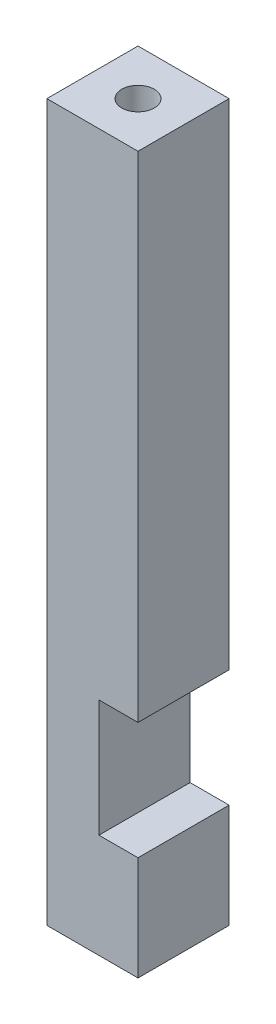
from build123d import *

# Parameters (mm, degrees)
BOSS_EXTRUDE1_DEPTH = 55
SKETCH2_R           = 1.25
CUT_EXTRUDE1_DEPTH  = 12
SKETCH4_W           = 7
SKETCH4_H           = 9
CUT_EXTRUDE3_DEPTH  = 3
CUT_EXTRUDE4_START  = -5
SKETCH3_R           = 1.25
CUT_EXTRUDE4_DEPTH  = 5


with BuildPart() as part:
    # Sketch1 → Boss-Extrude1 (new body)
    with BuildSketch(Plane(origin=(0, 0, 0), x_dir=(1, 0, 0), z_dir=(0, 1, 0))):
        Polygon((0, 3.5), (-3.5, 3.5), (-3.5, -3.5), (3.5, -3.5), (3.5, 3.5), align=None)
    extrude(amount=BOSS_EXTRUDE1_DEPTH)

    # Sketch2 → Cut-Extrude1 (cut)
    with BuildSketch(Plane(origin=(0, 55, 0), x_dir=(1, 0, 0), z_dir=(0, 1, 0))):
        with Locations(Location((0, 0, 0), (0, 0, 270))):
            Circle(SKETCH2_R)
    extrude(amount=-CUT_EXTRUDE1_DEPTH, mode=Mode.SUBTRACT)

    # Sketch4 → Cut-Extrude3 (cut)
    with BuildSketch(Plane(origin=(3.5, 0, 0), x_dir=(0, 0, -1), z_dir=(1, 0, 0))):
        with Locations((0, 12.5)):
            Rectangle(SKETCH4_W, SKETCH4_H)
    extrude(amount=-CUT_EXTRUDE3_DEPTH, mode=Mode.SUBTRACT)

    # Sketch3 → Cut-Extrude4 (cut)
    with BuildSketch(Plane.XZ.offset(CUT_EXTRUDE4_START)):
        with Locations(Location((0, 0, 0), (0, 0, 90))):
            Circle(SKETCH3_R)
    extrude(amount=CUT_EXTRUDE4_DEPTH, mode=Mode.SUBTRACT)


solid = part.part
